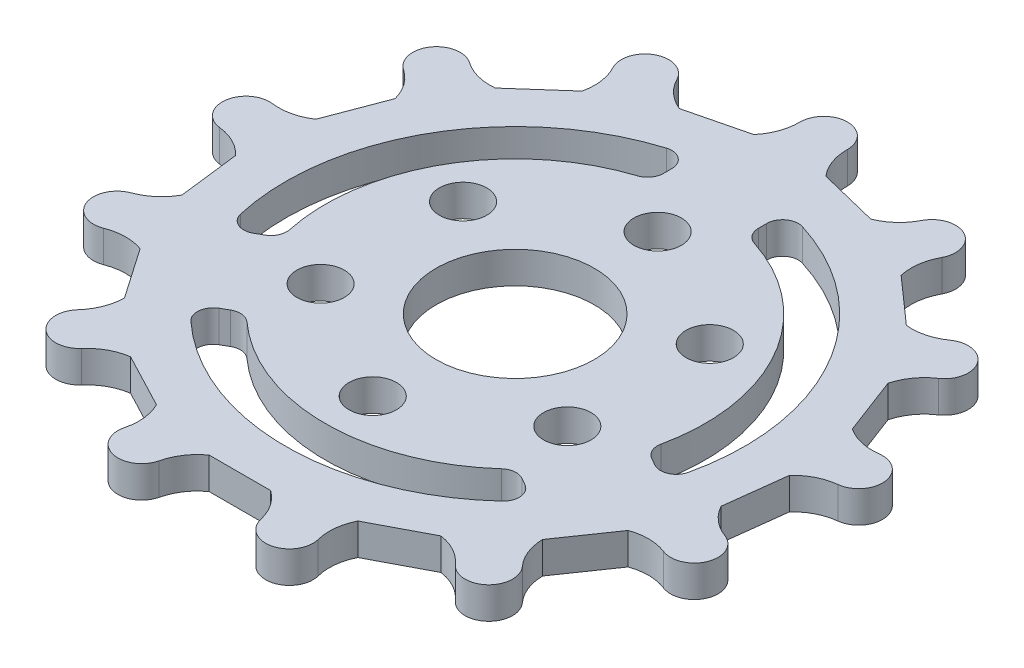
from build123d import *

# Parameters (mm, degrees)
SKETCH1_R           = 1.5
SKETCH1_R_2         = 1.75
BOSS_EXTRUDE3_DEPTH = 2
CUT_EXTRUDE1_DEPTH  = 2
FILLET1_R           = 1
SKETCH4_R           = 5
CUT_EXTRUDE2_DEPTH  = 10


with BuildPart() as part:
    # Sketch1 → Boss-Extrude3 (new body)
    with BuildSketch(Plane(origin=(0, 0, 0), x_dir=(1, 0, 0), z_dir=(0, 1, 0))):
        with BuildLine():
            Line((6.048353149, 16.421553647), (2.27592576, 17.351373488))
            ThreePointArc((2.27592576, 17.351373488), (1.69730064, 18.342788524), (1.499767326, 19.473580897))
            ThreePointArc((1.499767326, 19.473580897), (1.49994183, 19.486789936), (1.5, 19.5))
            ThreePointArc((1.5, 19.5), (0, 21), (-1.5, 19.5))
            ThreePointArc((-1.5, 19.5), (-1.49994183, 19.486789936), (-1.499767326, 19.473580897))
            ThreePointArc((-1.499767326, 19.473580897), (-1.69730064, 18.342788524), (-2.27592576, 17.351373488))
            Line((-2.27592576, 17.351373488), (-6.048353149, 16.421553647))
            ThreePointArc((-6.048353149, 16.421553647), (-7.021433788, 17.030507563), (-7.72184627, 17.939976175))
            ThreePointArc((-7.72184627, 17.939976175), (-7.7278303, 17.951753295), (-7.733917816, 17.963477258))
            ThreePointArc((-7.733917816, 17.963477258), (-9.759186613, 18.594576539), (-10.390285893, 16.569307742))
            ThreePointArc((-10.390285893, 16.569307742), (-10.384020417, 16.557678026), (-10.377802301, 16.546022918))
            ThreePointArc((-10.377802301, 16.546022918), (-10.027203946, 15.452957688), (-10.078817505, 14.30620277))
            Line((-10.078817505, 14.30620277), (-12.987027242, 11.729753767))
            ThreePointArc((-12.987027242, 11.729753767), (-14.131642352, 11.81674256), (-15.174477944, 12.296539112))
            ThreePointArc((-15.174477944, 12.296539112), (-15.18524964, 12.304186316), (-15.196088265, 12.31173836))
            ThreePointArc((-15.196088265, 12.31173836), (-17.282661184, 11.929359681), (-16.900282505, 9.842786762))
            ThreePointArc((-16.900282505, 9.842786762), (-16.889330102, 9.835400872), (-16.878407836, 9.827970489))
            ThreePointArc((-16.878407836, 9.827970489), (-16.059995669, 9.023040475), (-15.572773623, 7.983653406))
            Line((-15.572773623, 7.983653406), (-16.950529904, 4.350808657))
            ThreePointArc((-16.950529904, 4.350808657), (-18.004461959, 3.895904243), (-19.150819593, 3.836113127))
            ThreePointArc((-19.150819593, 3.836113127), (-19.163911289, 3.837878533), (-19.177018025, 3.839528576))
            ThreePointArc((-19.177018025, 3.839528576), (-20.846886356, 2.531270285), (-19.538628065, 0.861401954))
            ThreePointArc((-19.538628065, 0.861401954), (-19.5254978, 0.859951908), (-19.512373542, 0.858448461))
            ThreePointArc((-19.512373542, 0.858448461), (-18.413635928, 0.526053428), (-17.499194975, -0.167854741))
            Line((-17.499194975, -0.167854741), (-17.030870442, -4.024854283))
            ThreePointArc((-17.030870442, -4.024854283), (-17.752676308, -4.917438785), (-18.739939265, -5.503120145))
            ThreePointArc((-18.739939265, -5.503120145), (-18.752351812, -5.50764097), (-18.764724063, -5.512270933))
            ThreePointArc((-18.764724063, -5.512270933), (-19.635341096, -7.446702628), (-17.700909402, -8.317319661))
            ThreePointArc((-17.700909402, -8.317319661), (-17.688609259, -8.312501675), (-17.676289619, -8.307733764))
            ThreePointArc((-17.676289619, -8.307733764), (-16.548934104, -8.09144612), (-15.416761648, -8.280909389))
            Line((-15.416761648, -8.280909389), (-13.209643805, -11.478471612))
            ThreePointArc((-13.209643805, -11.478471612), (-13.433966457, -12.604255849), (-14.035964693, -13.581654911))
            ThreePointArc((-14.035964693, -13.581654911), (-14.044854525, -13.591426301), (-14.053657958, -13.601275602))
            ThreePointArc((-14.053657958, -13.601275602), (-13.925575823, -15.718725712), (-11.808125713, -15.590643577))
            ThreePointArc((-11.808125713, -15.590643577), (-11.799473508, -15.5806613), (-11.790780767, -15.570714303))
            ThreePointArc((-11.790780767, -15.570714303), (-10.893070914, -14.855292874), (-9.802534018, -14.496907492))
            Line((-9.802534018, -14.496907492), (-6.362246966, -16.302509425))
            ThreePointArc((-6.362246966, -16.302509425), (-6.037696789, -17.403589796), (-6.116519761, -18.548796214))
            ThreePointArc((-6.116519761, -18.548796214), (-6.119850325, -18.561579661), (-6.12306818, -18.574391943))
            ThreePointArc((-6.12306818, -18.574391943), (-5.02562895, -20.389778166), (-3.210242727, -19.292338936))
            ThreePointArc((-3.210242727, -19.292338936), (-3.207220575, -19.279479189), (-3.204146136, -19.266631842))
            ThreePointArc((-3.204146136, -19.266631842), (-2.741736452, -18.215971056), (-1.942663979, -17.391838795))
            Line((-1.942663979, -17.391838795), (1.942663979, -17.391838795))
            ThreePointArc((1.942663979, -17.391838795), (2.741736452, -18.215971056), (3.204146136, -19.266631842))
            ThreePointArc((3.204146136, -19.266631842), (3.207137832, -19.279498812), (3.210242727, -19.292338936))
            ThreePointArc((3.210242727, -19.292338936), (5.02562895, -20.389778166), (6.12306818, -18.574391943))
            ThreePointArc((6.12306818, -18.574391943), (6.11976794, -18.561600739), (6.116519761, -18.548796214))
            ThreePointArc((6.116519761, -18.548796214), (6.037696789, -17.403589796), (6.362246966, -16.302509425))
            Line((6.362246966, -16.302509425), (9.802534018, -14.496907492))
            ThreePointArc((9.802534018, -14.496907492), (10.893070914, -14.855292874), (11.790780767, -15.570714303))
            ThreePointArc((11.790780767, -15.570714303), (11.799409362, -15.580717128), (11.808125713, -15.590643577))
            ThreePointArc((11.808125713, -15.590643577), (13.925575823, -15.718725712), (14.053657958, -13.601275602))
            ThreePointArc((14.053657958, -13.601275602), (14.044791371, -13.591483251), (14.035964693, -13.581654911))
            ThreePointArc((14.035964693, -13.581654911), (13.433966458, -12.604255849), (13.209643805, -11.478471612))
            Line((13.209643805, -11.478471612), (15.416761648, -8.280909389))
            ThreePointArc((15.416761648, -8.280909389), (16.548934104, -8.09144612), (17.676289619, -8.307733764))
            ThreePointArc((17.676289619, -8.307733764), (17.688578405, -8.312580919), (17.700909402, -8.317319661))
            ThreePointArc((17.700909402, -8.317319661), (19.635341096, -7.446702628), (18.764724063, -5.512270933))
            ThreePointArc((18.764724063, -5.512270933), (18.752322358, -5.507720745), (18.739939265, -5.503120145))
            ThreePointArc((18.739939265, -5.503120145), (17.752676308, -4.917438785), (17.030870442, -4.024854283))
            Line((17.030870442, -4.024854283), (17.499194975, -0.167854741))
            ThreePointArc((17.499194975, -0.167854741), (18.413635928, 0.526053428), (19.512373542, 0.858448461))
            ThreePointArc((19.512373542, 0.858448461), (19.525507306, 0.859867402), (19.538628065, 0.861401954))
            ThreePointArc((19.538628065, 0.861401954), (20.846886356, 2.531270285), (19.177018025, 3.839528576))
            ThreePointArc((19.177018025, 3.839528576), (19.163922282, 3.837794208), (19.150819593, 3.836113127))
            ThreePointArc((19.150819593, 3.836113127), (18.004461959, 3.895904243), (16.950529904, 4.350808657))
            Line((16.950529904, 4.350808657), (15.572773623, 7.983653406))
            ThreePointArc((15.572773623, 7.983653406), (16.059995669, 9.023040475), (16.878407836, 9.827970489))
            ThreePointArc((16.878407836, 9.827970489), (16.889377792, 9.835330464), (16.900282505, 9.842786762))
            ThreePointArc((16.900282505, 9.842786762), (17.282661184, 11.929359681), (15.196088265, 12.31173836))
            ThreePointArc((15.196088265, 12.31173836), (15.185298562, 12.304116759), (15.174477944, 12.296539112))
            ThreePointArc((15.174477944, 12.296539112), (14.131642352, 11.81674256), (12.987027242, 11.729753767))
            Line((12.987027242, 11.729753767), (10.078817505, 14.30620277))
            ThreePointArc((10.078817505, 14.30620277), (10.027203946, 15.452957688), (10.377802301, 16.546022918))
            ThreePointArc((10.377802301, 16.546022918), (10.384095364, 16.557637845), (10.390285893, 16.569307742))
            ThreePointArc((10.390285893, 16.569307742), (9.759186613, 18.594576539), (7.733917816, 17.963477258))
            ThreePointArc((7.733917816, 17.963477258), (7.727905944, 17.95171444), (7.72184627, 17.939976175))
            ThreePointArc((7.72184627, 17.939976175), (7.021433788, 17.030507563), (6.048353149, 16.421553647))
        make_face()
        with Locations(Location((0, -9, 0), (0, 0, 270))):
            Circle(SKETCH1_R, mode=Mode.SUBTRACT)
        with Locations(Location((-7.794228634, -4.5, 0), (0, 0, 270))):
            Circle(SKETCH1_R, mode=Mode.SUBTRACT)
        with Locations(Location((0, 0, 0), (0, 0, 270))):
            Circle(SKETCH1_R_2, mode=Mode.SUBTRACT)
        with Locations(Location((7.794228634, -4.5, 0), (0, 0, 270))):
            Circle(SKETCH1_R, mode=Mode.SUBTRACT)
        with Locations(Location((-7.794228634, 4.5, 0), (0, 0, 270))):
            Circle(SKETCH1_R, mode=Mode.SUBTRACT)
        with Locations(Location((0, 9, 0), (0, 0, 270))):
            Circle(SKETCH1_R, mode=Mode.SUBTRACT)
        with Locations(Location((7.794228634, 4.5, 0), (0, 0, 270))):
            Circle(SKETCH1_R, mode=Mode.SUBTRACT)
    extrude(amount=BOSS_EXTRUDE3_DEPTH)

    # Sketch3 → Cut-Extrude1 (cut)
    with BuildSketch(Plane(origin=(0, 2, 0), x_dir=(1, 0, 0), z_dir=(0, 1, 0))):
        with BuildLine():
            Line((-3, 14.186260959), (-3, 11.618950039))
            ThreePointArc((-3, 11.618950039), (-10.392304845, 6), (-11.562305899, -3.211398808))
            Line((-11.562305899, -3.211398808), (-13.785662375, -4.495054268))
            ThreePointArc((-13.785662375, -4.495054268), (-12.557368355, 7.25), (-3, 14.186260959))
        make_face()
        with BuildLine():
            Line((3, 14.186260959), (3, 11.618950039))
            ThreePointArc((3, 11.618950039), (10.392304845, 6), (11.562305899, -3.211398808))
            Line((11.562305899, -3.211398808), (13.785662375, -4.495054268))
            ThreePointArc((13.785662375, -4.495054268), (12.557368355, 7.25), (3, 14.186260959))
        make_face()
        with BuildLine():
            Line((10.785662375, -9.691206691), (8.562305899, -8.407551231))
            ThreePointArc((8.562305899, -8.407551231), (0, -12), (-8.562305899, -8.407551231))
            Line((-8.562305899, -8.407551231), (-10.785662375, -9.691206691))
            ThreePointArc((-10.785662375, -9.691206691), (0, -14.5), (10.785662375, -9.691206691))
        make_face()
    extrude(amount=-CUT_EXTRUDE1_DEPTH, mode=Mode.SUBTRACT)

    # Fillet1
    fillet1_edges = [part.edges().sort_by_distance(p)[0] for p in [
        (-8.562305899, 1, 8.407551231),
        (8.562305899, 1, 8.407551231),
        (10.785662375, 1, 9.691206691),
        (-10.785662375, 1, 9.691206691),
        (11.562305899, 1, 3.211398808),
        (3, 1, -11.618950039),
        (3, 1, -14.186260959),
        (13.785662375, 1, 4.495054268),
        (-3, 1, -11.618950039),
        (-11.562305899, 1, 3.211398808),
        (-13.785662375, 1, 4.495054268),
        (-3, 1, -14.186260959),
    ]]
    fillet(fillet1_edges, radius=FILLET1_R)

    # Sketch4 → Cut-Extrude2 (cut)
    with BuildSketch(Plane(origin=(0, 2, 0), x_dir=(1, 0, 0), z_dir=(0, 1, 0))):
        with Locations(Location((0, 0, 0), (0, 0, 270))):
            Circle(SKETCH4_R)
    extrude(amount=-CUT_EXTRUDE2_DEPTH, mode=Mode.SUBTRACT)


solid = part.part
